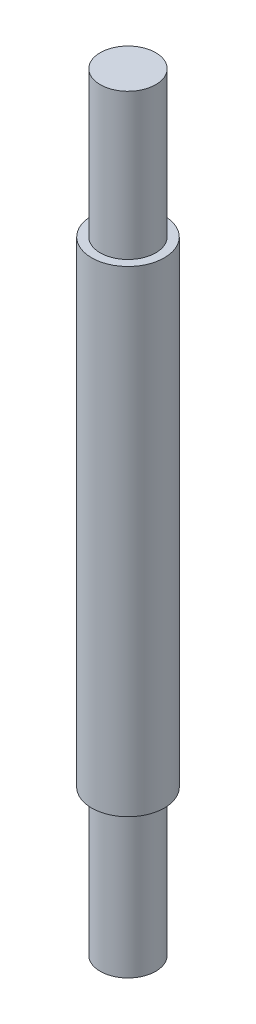
from build123d import *

# Parameters (mm, degrees)
SKETCH1_R           = 0.095
BOSS_EXTRUDE1_DEPTH = 1.315
SKETCH2_R           = 0.124286751
SKETCH2_R_2         = 0.095
BOSS_EXTRUDE2_DEPTH = 0.816


with BuildPart() as part:
    # Sketch1 → Boss-Extrude1 (new, symmetric)
    with BuildSketch(Plane(origin=(0, 0, 0), x_dir=(1, 0, 0), z_dir=(0, 1, 0))):
        with Locations(Location((0, 0, 0), (0, 0, 270))):
            Circle(SKETCH1_R)
    extrude(amount=BOSS_EXTRUDE1_DEPTH, both=True)

    # Sketch2 → Boss-Extrude2 (add, symmetric)
    with BuildSketch(Plane(origin=(0, 0, 0), x_dir=(1, 0, 0), z_dir=(0, 1, 0))):
        with Locations(Location((0, 0, 0), (0, 0, 270))):
            Circle(SKETCH2_R)
        with Locations(Location((0, 0, 0), (0, 0, 270))):
            Circle(SKETCH2_R_2, mode=Mode.SUBTRACT)
    extrude(amount=BOSS_EXTRUDE2_DEPTH, both=True)


solid = part.part
